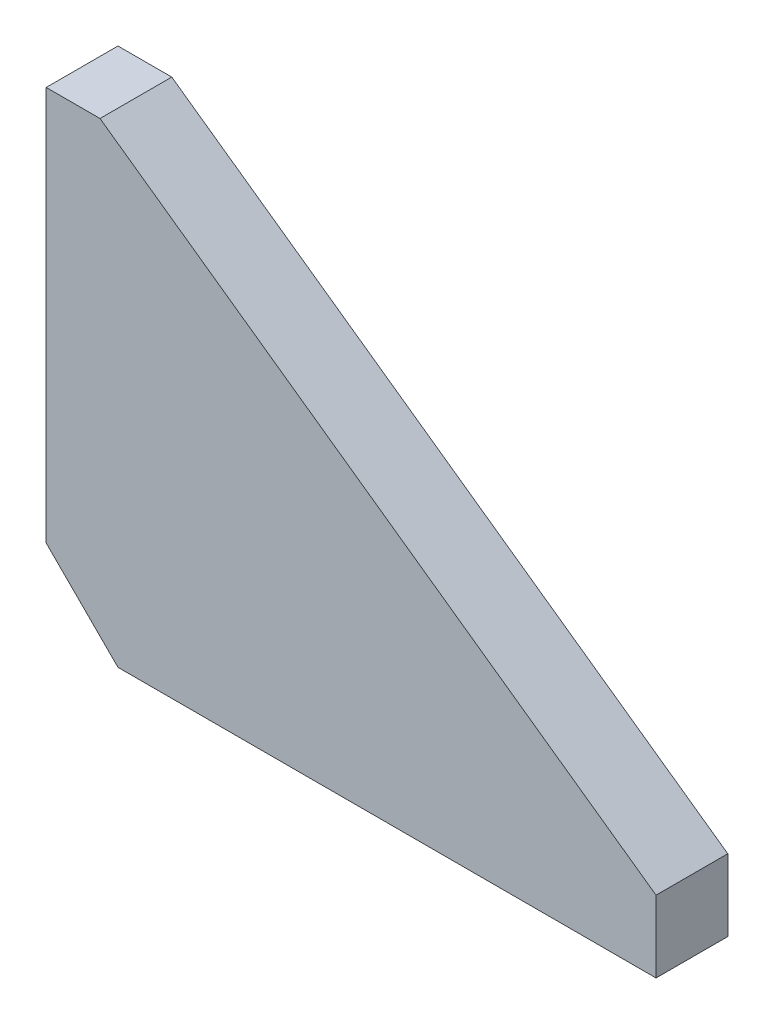
from build123d import *

# Parameters (mm, degrees)
EXTRUDE_1_DEPTH = 4
CHAMFER_1_SIZE  = 10
CHAMFER_2_SIZE  = 2
CHAMFER_3_SIZE  = 2


with BuildPart() as part:
    # Эскиз1 → Бобышка-Вытянуть1 (new, symmetric)
    with BuildSketch(Plane.XY):
        Polygon((0, 0), (0, 52), (8, 52), (70, 8), (70, 0), align=None)
    extrude(amount=EXTRUDE_1_DEPTH, both=True)

    # Фаска1
    chamfer_1_edges = [part.edges().sort_by_distance(p)[0] for p in [
        (0, 0, 0),
    ]]
    chamfer(chamfer_1_edges, length=CHAMFER_1_SIZE)

    # Фаска2
    chamfer_2_edges = [part.edges().sort_by_distance(p)[0] for p in [
        (0, 31, 4),
        (0, 31, -4),
    ]]
    chamfer(chamfer_2_edges, length=CHAMFER_2_SIZE)

    # Фаска3
    chamfer_3_edges = [part.edges().sort_by_distance(p)[0] for p in [
        (0, 52, 0),
    ]]
    chamfer(chamfer_3_edges, length=CHAMFER_3_SIZE)


solid = part.part
